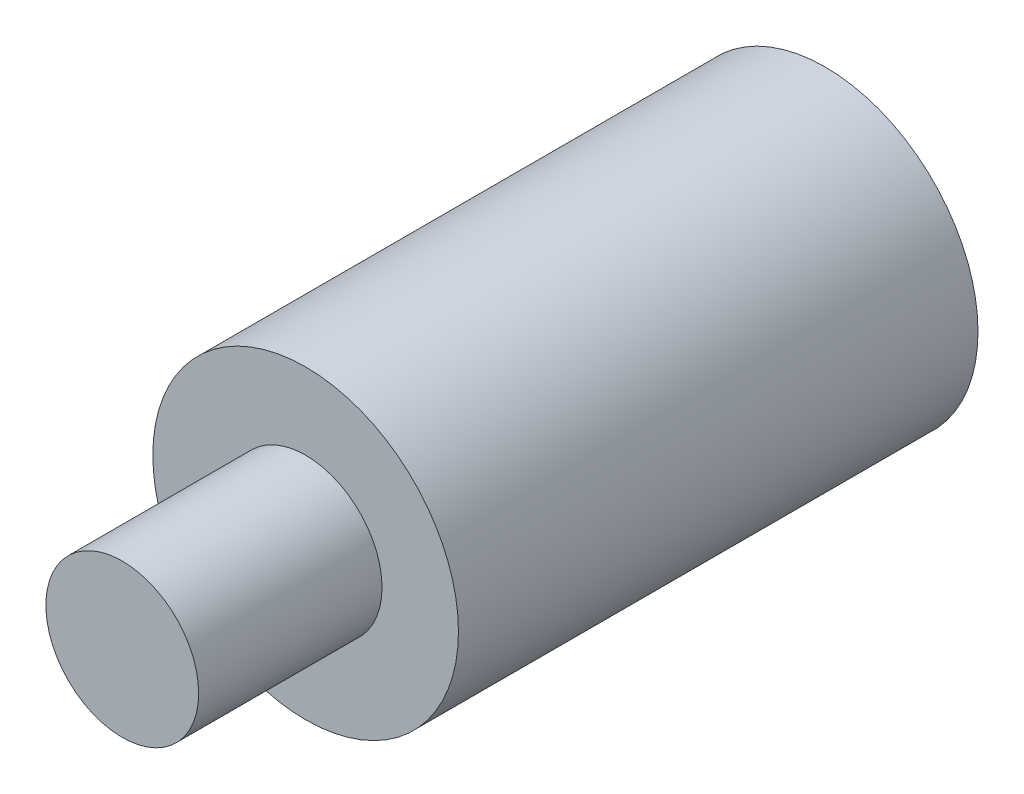
from build123d import *

# Parameters (mm, degrees)
CROQUIS1_R              = 10
SALIENTE_EXTRUIR1_DEPTH = 34
CROQUIS2_R              = 5
SALIENTE_EXTRUIR2_DEPTH = 12


with BuildPart() as part:
    # Croquis1 → Saliente-Extruir1 (new body)
    with BuildSketch(Plane.XY):
        Circle(CROQUIS1_R)
    extrude(amount=SALIENTE_EXTRUIR1_DEPTH)

    # Croquis2 → Saliente-Extruir2 (add)
    with BuildSketch(Plane.XY.offset(34)):
        Circle(CROQUIS2_R)
    extrude(amount=SALIENTE_EXTRUIR2_DEPTH)


solid = part.part
